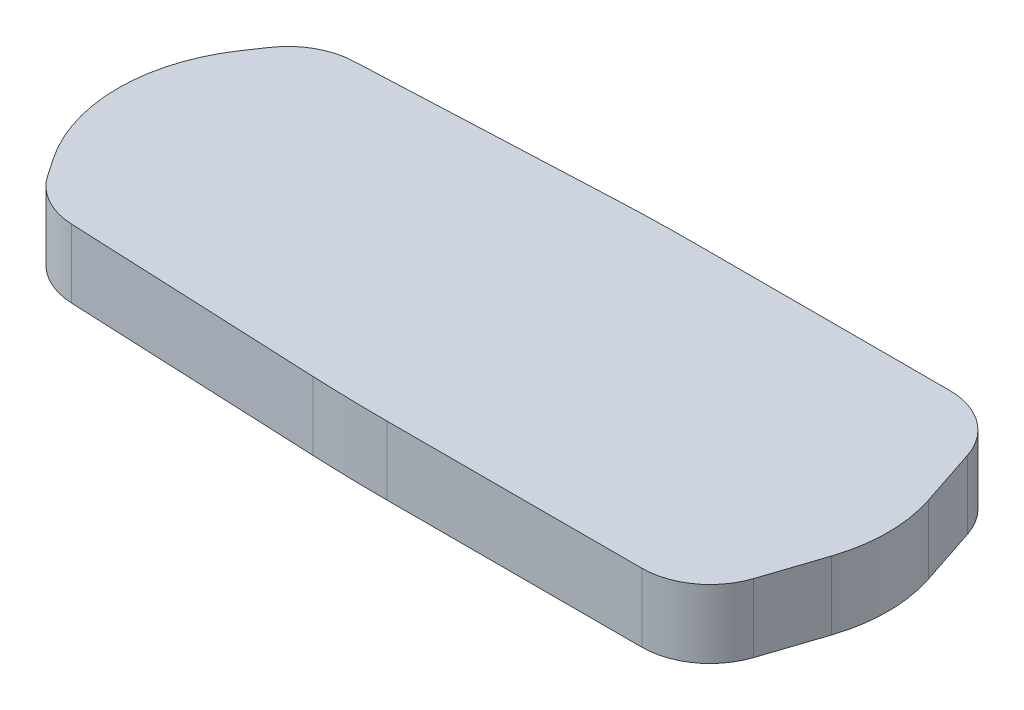
from build123d import *

# Parameters (mm, degrees)
EXTRUDE_1_DEPTH = 40


with BuildPart() as part:
    # Эскиз1 → Бобышка-Вытянуть1 (new body)
    with BuildSketch(Plane(origin=(0, 0, 0), x_dir=(1, 0, 0), z_dir=(0, 1, 0))):
        with BuildLine():
            Line((16.802878713, 54.719508551), (23.730271947, 64.935621721))
            ThreePointArc((23.730271947, 64.935621721), (37.321118073, 77.402760932), (55.060758699, 82.447144831))
            Line((55.060758699, 82.447144831), (202.81064549, 89.013806466))
            ThreePointArc((202.81064549, 89.013806466), (225.005476825, 89.753421216), (247.21125911, 90))
            Line((247.21125911, 90), (396.111111111, 90))
            ThreePointArc((396.111111111, 90), (419.530733265, 82.427169136), (434.082713545, 62.576064909))
            Line((434.082713545, 62.576064909), (445.436105477, 28.296146045))
            ThreePointArc((445.436105477, 28.296146045), (450, 0), (445.436105477, -28.296146045))
            Line((445.436105477, -28.296146045), (434.082713545, -62.576064909))
            ThreePointArc((434.082713545, -62.576064909), (419.530733265, -82.427169136), (396.111111111, -90))
            Line((396.111111111, -90), (247.21125911, -90))
            ThreePointArc((247.21125911, -90), (225.005476825, -89.753421216), (202.81064549, -89.013806466))
            Line((202.81064549, -89.013806466), (55.060758699, -82.447144831))
            ThreePointArc((55.060758699, -82.447144831), (37.321118073, -77.402760932), (23.730271947, -64.935621721))
            Line((23.730271947, -64.935621721), (16.802878713, -54.719508551))
            ThreePointArc((16.802878713, -54.719508551), (0, 0), (16.802878713, 54.719508551))
        make_face()
    extrude(amount=EXTRUDE_1_DEPTH)


solid = part.part
